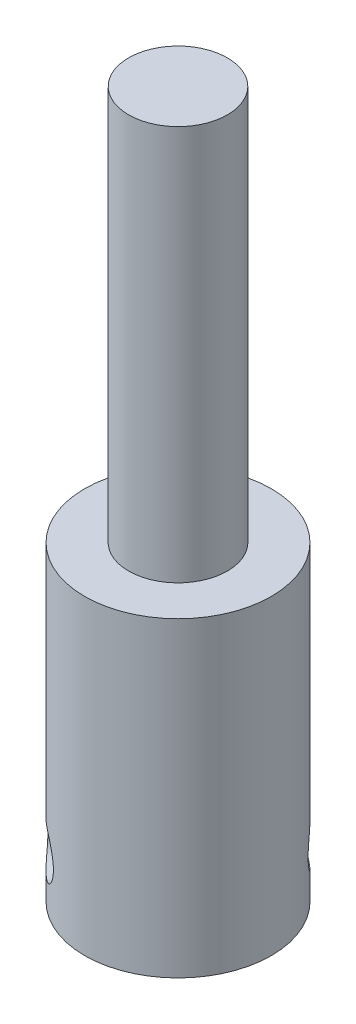
from build123d import *

# Parameters (mm, degrees)
SKETCH1_R             = 6
BOSS_EXTRUDE1_DEPTH   = 20
SKETCH2_R             = 3.175
BOSS_EXTRUDE2_DEPTH   = 25.4
SKETCH4_R             = 2.5
CUT_EXTRUDE1_DEPTH    = 6.5
F_3_0MM_DOWEL_HOLE1_D = 3


with BuildPart() as part:
    # Sketch1 → Boss-Extrude1 (new body)
    with BuildSketch(Plane(origin=(0, 0, 0), x_dir=(1, 0, 0), z_dir=(0, 1, 0))):
        with Locations(Location((0, 0, 0), (0, 0, 270))):
            Circle(SKETCH1_R)
    extrude(amount=BOSS_EXTRUDE1_DEPTH)

    # Sketch2 → Boss-Extrude2 (add)
    with BuildSketch(Plane(origin=(0, 20, 0), x_dir=(1, 0, 0), z_dir=(0, 1, 0))):
        with Locations(Location((0, 0, 0), (0, 0, 270))):
            Circle(SKETCH2_R)
    extrude(amount=BOSS_EXTRUDE2_DEPTH)

    # Sketch4 → Cut-Extrude1 (cut)
    with BuildSketch(Plane(origin=(0, 0, 0), x_dir=(-1, 0, 0), z_dir=(0, -1, 0))):
        with Locations(Location((0, 0, 0), (0, 0, 90))):
            Circle(SKETCH4_R)
    extrude(amount=-CUT_EXTRUDE1_DEPTH, mode=Mode.SUBTRACT)

    # Ø3.0mm Dowel Hole1 (through all)
    with Locations(Plane(origin=(-3.874280367, 3.174847953, 4.581479197), x_dir=(0.763579866236, 0, 0.645713394533), z_dir=(-0.645713394533, 0, 0.763579866236))):
        with Locations((0, 0)):
            Hole(F_3_0MM_DOWEL_HOLE1_D / 2)


solid = part.part
